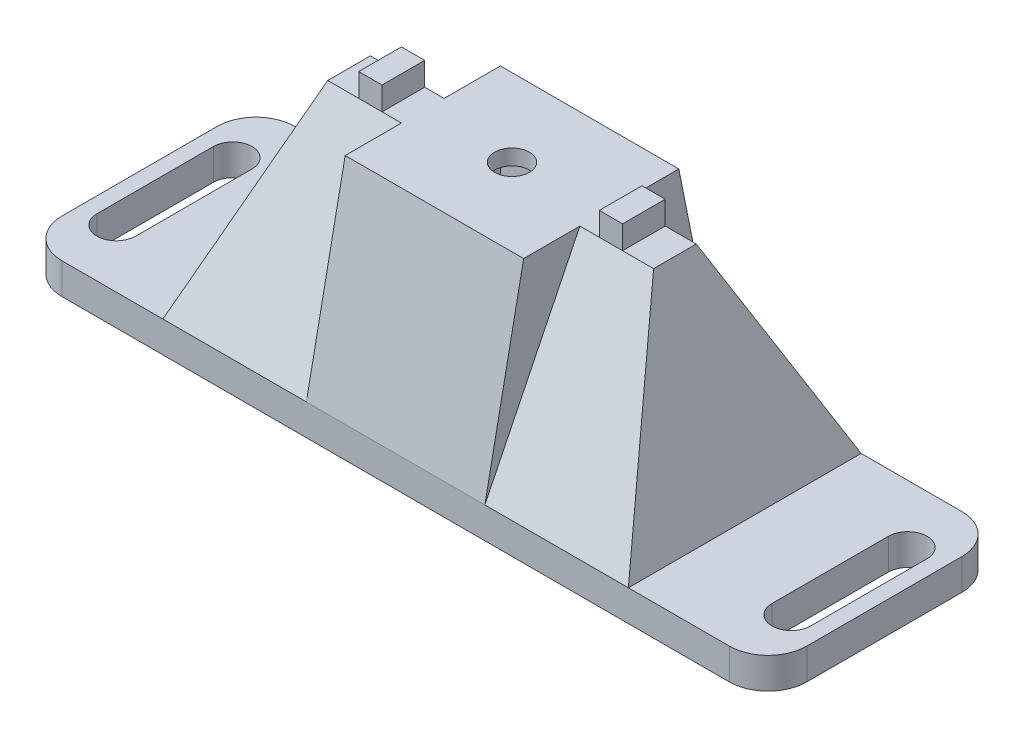
from build123d import *

# Parameters (mm, degrees)
BOSS_EXTRUDE1_DEPTH     = 4
BOSS_EXTRUDE2_DEPTH     = 30
BOSS_EXTRUDE3_DEPTH     = 11.5
CUT_EXTRUDE1_DEPTH      = 57.160484328
CUT_EXTRUDE1_DEPTH_BACK = 57.160484328
SKETCH4_3_W             = 3
SKETCH4_3_H             = 3
BOSS_EXTRUDE4_DEPTH     = 2.75
SKETCH5_W               = 21
SKETCH5_H               = 18
CUT_EXTRUDE3_DEPTH      = 27
M4_CLEARANCE_HOLE1_D    = 4.5


with BuildPart() as part:
    # Sketch2 → Boss-Extrude1 (new body)
    with BuildSketch(Plane(origin=(0, 0, 0), x_dir=(1, 0, 0), z_dir=(0, 1, 0))):
        with BuildLine():
            Line((-43, 15), (43, 15))
            ThreePointArc((43, 15), (46.535533906, 13.535533906), (48, 10))
            Line((48, 10), (48, -10))
            ThreePointArc((48, -10), (46.535533906, -13.535533906), (43, -15))
            Line((43, -15), (-43, -15))
            ThreePointArc((-43, -15), (-46.535533906, -13.535533906), (-48, -10))
            Line((-48, -10), (-48, 10))
            ThreePointArc((-48, 10), (-46.535533906, 13.535533906), (-43, 15))
        make_face()
        with BuildLine():
            Line((-46, -7.5), (-46, 7.5))
            ThreePointArc((-46, 7.5), (-43.5, 10), (-41, 7.5))
            Line((-41, 7.5), (-41, -7.5))
            ThreePointArc((-41, -7.5), (-43.5, -10), (-46, -7.5))
        make_face(mode=Mode.SUBTRACT)
        with BuildLine():
            Line((46, -7.5), (46, 7.5))
            ThreePointArc((46, 7.5), (43.5, 10), (41, 7.5))
            Line((41, 7.5), (41, -7.5))
            ThreePointArc((41, -7.5), (43.5, -10), (46, -7.5))
        make_face(mode=Mode.SUBTRACT)
    extrude(amount=-BOSS_EXTRUDE1_DEPTH)

    # Sketch3 → Boss-Extrude2 (add, symmetric)
    with BuildSketch(Plane(origin=(0, 0, 0), x_dir=(0, 0, -1), z_dir=(1, 0, 0))):
        Polygon((-15, 0), (-2.75, 25), (2.75, 25), (15, 0), align=None)
    extrude(amount=BOSS_EXTRUDE2_DEPTH, both=True)

    # Sketch3<3> → Boss-Extrude3 (add, symmetric)
    with BuildSketch(Plane(origin=(0, 0, 0), x_dir=(0, 0, -1), z_dir=(1, 0, 0))):
        Polygon((-10, 25), (-15, 0), (-2.75, 25), align=None)
        Polygon((2.75, 25), (15, 0), (10, 25), align=None)
    extrude(amount=BOSS_EXTRUDE3_DEPTH, both=True)

    # Sketch4 → Cut-Extrude1 (cut, two sides: drawn at the far end of the back side and taken through both)
    with BuildSketch(Plane.XY.offset(-CUT_EXTRUDE1_DEPTH_BACK)):
        Polygon((21, 25), (30, 0), (30, 25), align=None)
        Polygon((-30, 25), (-30, 0), (-21, 25), align=None)
    extrude(amount=CUT_EXTRUDE1_DEPTH + CUT_EXTRUDE1_DEPTH_BACK, mode=Mode.SUBTRACT)

    # Sketch4<3> → Boss-Extrude4 (add, symmetric)
    with BuildSketch(Plane.XY):
        with Locations((15.5, 26.5)):
            Rectangle(SKETCH4_3_W, SKETCH4_3_H)
        with Locations((-15.5, 26.5)):
            Rectangle(SKETCH4_3_W, SKETCH4_3_H)
    extrude(amount=BOSS_EXTRUDE4_DEPTH, both=True)

    # Sketch5 → Cut-Extrude3 (cut)
    with BuildSketch(Plane.XZ.offset(4)):
        Rectangle(SKETCH5_W, SKETCH5_H)
    extrude(amount=-CUT_EXTRUDE3_DEPTH, mode=Mode.SUBTRACT)

    # M4 Clearance Hole1 (through all)
    with Locations(Plane(origin=(0, 25, 0), x_dir=(1, 0, 0), z_dir=(0, 1, 0))):
        with Locations((0, 0)):
            Hole(M4_CLEARANCE_HOLE1_D / 2)


solid = part.part
